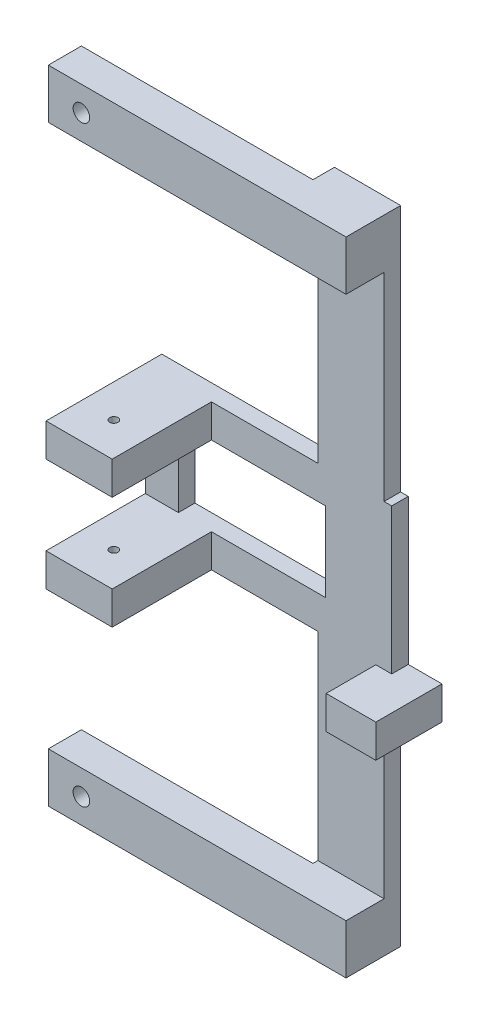
from build123d import *

# Parameters (mm, degrees)
SKETCH2_W           = 22.606
SKETCH2_H           = 12.192
BOSS_EXTRUDE2_DEPTH = 2.54
SKETCH3_W           = 10.16
SKETCH3_H           = 5.08
BOSS_EXTRUDE3_DEPTH = 15.24
SKETCH5_W           = 10.16
SKETCH5_H           = 7.62
BOSS_EXTRUDE4_DEPTH = 5.842
SKETCH6_W           = 5.08
SKETCH6_H           = 7.62
BOSS_EXTRUDE5_DEPTH = 35.56
SKETCH8_R           = 1.27
CUT_EXTRUDE2_DEPTH  = 5.08
CUT_EXTRUDE4_START  = -22.352
SKETCH4_R           = 0.635
CUT_EXTRUDE4_DEPTH  = 22.352
SKETCH16_W          = 10.16
SKETCH16_H          = 5.08
BOSS_EXTRUDE8_DEPTH = 6.35
SKETCH20_R          = 0.889
CUT_EXTRUDE7_DEPTH  = 3.556
SKETCH21_W          = 7.62
SKETCH21_H          = 5.08
BOSS_EXTRUDE9_DEPTH = 1.27


with BuildPart() as part:
    # Sketch2 → Boss-Extrude2 (new body)
    with BuildSketch(Plane.XY):
        Polygon((26.857381616, 17.540573563), (26.857381616, -4.811426437), (25.680950898, -4.811426437), (25.680950898, -42.911426437), (15.520950898, -42.911426437), (15.520950898, -4.811426437), (-10.988618384, -4.811426437), (-10.988618384, 17.540573563), (15.520950898, 17.540573563), (15.520950898, 55.640573563), (25.680950898, 55.640573563), (25.680950898, 17.540573563), align=None)
        with Locations((5.394381616, 6.364573563)):
            Rectangle(SKETCH2_W, SKETCH2_H, mode=Mode.SUBTRACT)
    extrude(amount=BOSS_EXTRUDE2_DEPTH)

    # Sketch3 → Boss-Extrude3 (add)
    with BuildSketch(Plane.XY.offset(2.54)):
        with Locations((-5.908618384, -2.271426437)):
            Rectangle(SKETCH3_W, SKETCH3_H)
    boss_extrude3 = extrude(amount=BOSS_EXTRUDE3_DEPTH)

    # Sketch5 → Boss-Extrude4 (add)
    with BuildSketch(Plane.XY.offset(2.54)):
        with Locations((20.600950898, -39.101426437)):
            Rectangle(SKETCH5_W, SKETCH5_H)
    boss_extrude4 = extrude(amount=BOSS_EXTRUDE4_DEPTH)

    # Sketch6 → Boss-Extrude5 (add)
    with BuildSketch(Plane.ZY.offset(-15.520950898)):
        with Locations((5.842, -39.101426437)):
            Rectangle(SKETCH6_W, SKETCH6_H)
    boss_extrude5 = extrude(amount=BOSS_EXTRUDE5_DEPTH)

    # Sketch8 → Cut-Extrude2 (cut)
    with BuildSketch(Plane.XY.offset(8.382)):
        with Locations((-14.959049102, -39.101426437)):
            Circle(SKETCH8_R)
    cut_extrude2 = extrude(amount=-CUT_EXTRUDE2_DEPTH, mode=Mode.SUBTRACT)

    # Mirror6: Boss-Extrude3, Boss-Extrude4, Boss-Extrude5, Cut-Extrude2 across plane
    add(boss_extrude3.mirror(Plane.ZX.offset(6.364573563)))
    add(boss_extrude4.mirror(Plane.ZX.offset(6.364573563)))
    add(boss_extrude5.mirror(Plane.ZX.offset(6.364573563)))
    add(cut_extrude2.mirror(Plane.ZX.offset(6.364573563)), mode=Mode.SUBTRACT)

    # Sketch4 → Cut-Extrude4 (cut)
    with BuildSketch(Plane(origin=(0, 17.540573563, 0), x_dir=(1, 0, 0), z_dir=(0, 1, 0)).offset(CUT_EXTRUDE4_START)):
        with Locations(Location((-5.908618384, -12.446, 0), (0, 0, 270))):
            Circle(SKETCH4_R)
    extrude(amount=CUT_EXTRUDE4_DEPTH, mode=Mode.SUBTRACT)

    # Sketch16 → Boss-Extrude8 (add)
    with BuildSketch(Plane(origin=(25.680950898, 0, 0), x_dir=(0, 0, -1), z_dir=(1, 0, 0))):
        with Locations((-5.08, -7.351426437)):
            Rectangle(SKETCH16_W, SKETCH16_H)
    extrude(amount=BOSS_EXTRUDE8_DEPTH)

    # Sketch20 → Cut-Extrude7 (cut)
    with BuildSketch(Plane(origin=(0, -9.891426437, 0), x_dir=(-1, 0, 0), z_dir=(0, -1, 0))):
        with Locations(Location((-28.982950898, -5.588, 0), (0, 0, 90))):
            Circle(SKETCH20_R)
    extrude(amount=-CUT_EXTRUDE7_DEPTH, mode=Mode.SUBTRACT)

    # Sketch21 → Boss-Extrude9 (add)
    with BuildSketch(Plane.ZY.offset(-25.680950898)):
        with Locations((6.35, -7.351426437)):
            Rectangle(SKETCH21_W, SKETCH21_H)
    extrude(amount=BOSS_EXTRUDE9_DEPTH)


solid = part.part
